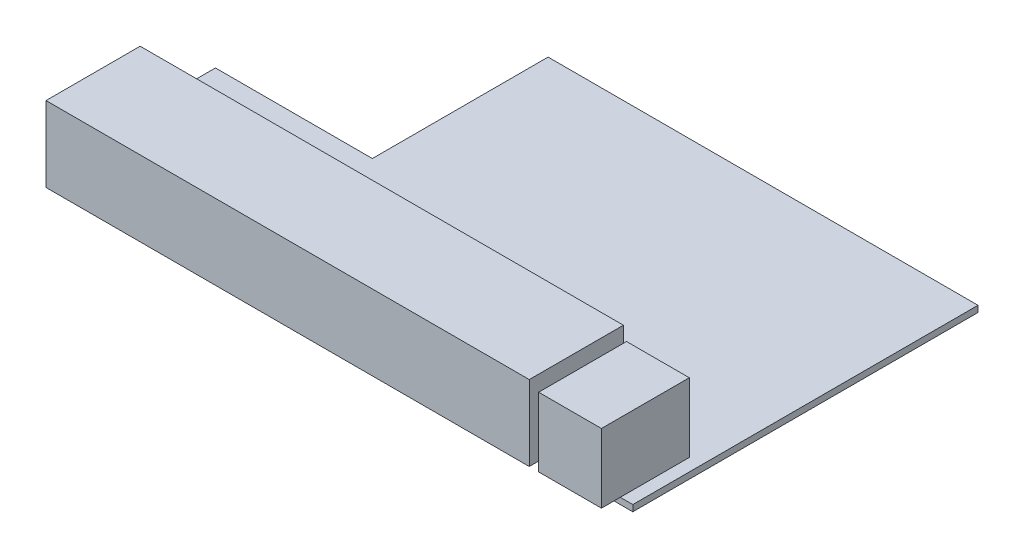
from build123d import *

# Parameters (mm, degrees)
BOSS_EXTRUDE1_DEPTH = 1
SKETCH2_W           = 77
SKETCH2_H           = 15
BOSS_EXTRUDE2_DEPTH = 12
SKETCH3_W           = 10
SKETCH3_H           = 14
BOSS_EXTRUDE3_DEPTH = 11


with BuildPart() as part:
    # Sketch1 → Boss-Extrude1 (new body)
    with BuildSketch(Plane(origin=(0, 0, 0), x_dir=(1, 0, 0), z_dir=(0, 1, 0))):
        Polygon((-46.9670263, -0.627662529), (-21.9670263, -0.627662529), (-21.9670263, 27.372337471), (46.5329737, 27.372337471), (46.5329737, -27.627662529), (-46.9670263, -27.627662529), align=None)
    extrude(amount=BOSS_EXTRUDE1_DEPTH)

    # Sketch2 → Boss-Extrude2 (add)
    with BuildSketch(Plane(origin=(0, 1, 0), x_dir=(1, 0, 0), z_dir=(0, 1, 0))):
        with Locations((-5.4670263, -23.127662529)):
            Rectangle(SKETCH2_W, SKETCH2_H)
    extrude(amount=BOSS_EXTRUDE2_DEPTH)

    # Sketch3 → Boss-Extrude3 (add)
    with BuildSketch(Plane(origin=(0, 1, 0), x_dir=(1, 0, 0), z_dir=(0, 1, 0))):
        with Locations((39.5329737, -23.627662529)):
            Rectangle(SKETCH3_W, SKETCH3_H)
    extrude(amount=BOSS_EXTRUDE3_DEPTH)


solid = part.part
